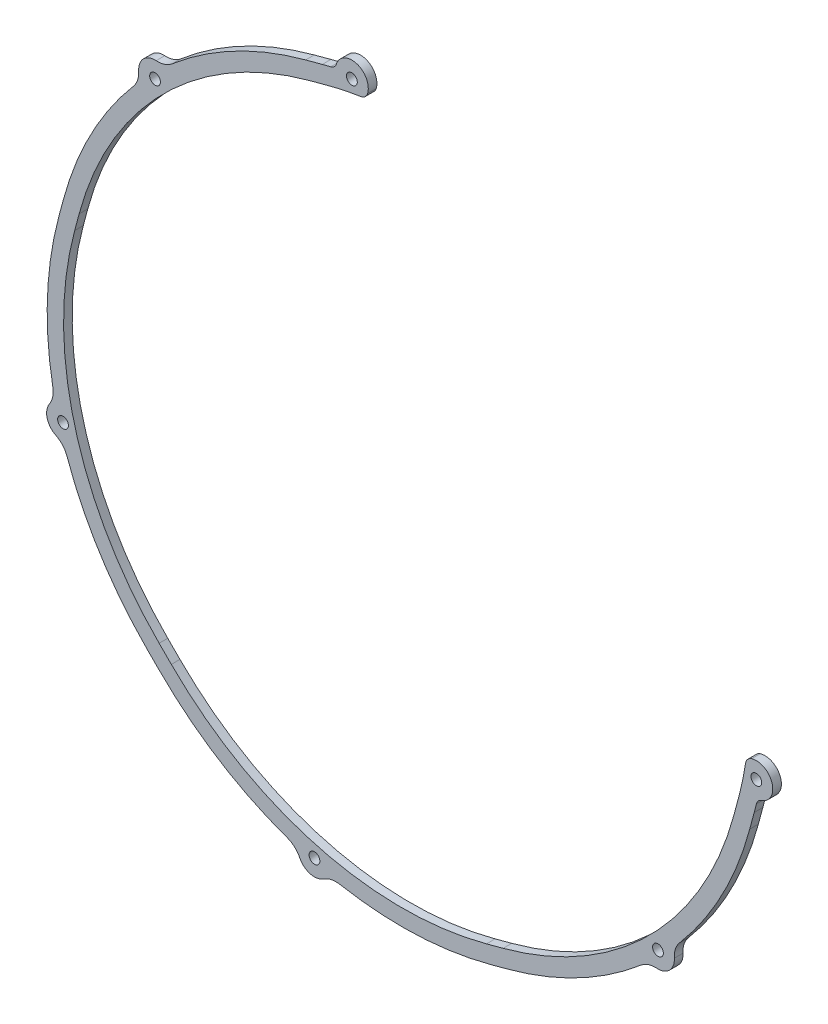
from build123d import *

# Parameters (mm, degrees)
SKETCH_1_R      = 1.249999998
SKETCH_1_R_2    = 1.25
EXTRUDE_1_DEPTH = 2
SKETCH_2_R      = 1.249999998
SKETCH_2_R_2    = 1.25
EXTRUDE_2_DEPTH = 2


with BuildPart() as part:
    # 草图1 → 凸台-拉伸1 (new body)
    with BuildSketch(Plane.XY):
        with BuildLine():
            Line((-6.26112666, -107.981945189), (-5.225850479, -104.118241884))
            ThreePointArc((-5.225850479, -104.118241884), (-4.973189102, -103.150666115), (-4.732884138, -102.17994774))
            ThreePointArc((-4.732884138, -102.17994774), (-4.069242074, -100.937454399), (-2.884606032, -100.175320593))
            ThreePointArc((-2.884606032, -100.175320593), (-1.923934791, -95.399938144), (-6.515491171, -97.026215112))
            ThreePointArc((-6.515491171, -97.026215112), (-7.154297104, -100.225141497), (-7.930442698, -103.393548202))
            Line((-7.930442698, -103.393548202), (-8.965718973, -107.257251863))
            ThreePointArc((-8.965718973, -107.257251863), (-28.541729969, -141.163897516), (-62.448375622, -160.739908512))
            Line((-62.448375622, -160.739908512), (-66.312078927, -161.775184692))
            ThreePointArc((-66.312078927, -161.775184692), (-105.464100918, -161.775184692), (-139.370746572, -142.199173697))
            Line((-139.370746572, -142.199173697), (-142.199173697, -139.370746572))
            ThreePointArc((-142.199173697, -139.370746572), (-161.775184692, -105.464100918), (-161.775184692, -66.312078927))
            Line((-161.775184692, -66.312078927), (-160.739908512, -62.448375622))
            ThreePointArc((-160.739908512, -62.448375622), (-141.163897516, -28.541729969), (-107.257251863, -8.965718973))
            Line((-107.257251863, -8.965718973), (-103.393548557, -7.930442793))
            ThreePointArc((-103.393548557, -7.930442793), (-100.225141676, -7.154297144), (-97.026215112, -6.515491171))
            ThreePointArc((-97.026215112, -6.515491171), (-95.399938144, -1.923934791), (-100.175320593, -2.884606032))
            ThreePointArc((-100.175320593, -2.884606032), (-100.937454399, -4.069242074), (-102.17994774, -4.732884138))
            ThreePointArc((-102.17994774, -4.732884138), (-103.150666115, -4.973189102), (-104.118241884, -5.225850479))
            Line((-104.118241884, -5.225850479), (-107.981945189, -6.26112666))
            ThreePointArc((-107.981945189, -6.26112666), (-124.151656982, -12.583052357), (-138.534502117, -22.307253601))
            ThreePointArc((-138.534502117, -22.307253601), (-140.602334013, -23.470064414), (-142.95588592, -23.768143523))
            ThreePointArc((-142.95588592, -23.768143523), (-145.123695491, -24.581931994), (-145.937483961, -26.749741565))
            ThreePointArc((-145.937483961, -26.749741565), (-146.235563071, -29.103293472), (-147.398373884, -31.171125368))
            ThreePointArc((-147.398373884, -31.171125368), (-157.122575127, -45.553970503), (-163.444500825, -61.723682296))
            Line((-163.444500825, -61.723682296), (-164.479777006, -65.587385601))
            ThreePointArc((-164.479777006, -65.587385601), (-167.089684647, -82.751729635), (-165.859701906, -100.069739522))
            ThreePointArc((-165.859701906, -100.069739522), (-165.88659415, -102.441939881), (-166.805226023, -104.629215177))
            ThreePointArc((-166.805226023, -104.629215177), (-167.184369319, -106.913487571), (-165.713885396, -108.702153845))
            ThreePointArc((-165.713885396, -108.702153845), (-163.824689209, -110.13707388), (-162.615299663, -112.178013531))
            ThreePointArc((-162.615299663, -112.178013531), (-155.02149102, -127.790841407), (-144.179072684, -141.350645559))
            Line((-144.179072684, -141.350645559), (-141.350645559, -144.179072684))
            ThreePointArc((-141.350645559, -144.179072684), (-127.790841407, -155.02149102), (-112.178013531, -162.615299663))
            ThreePointArc((-112.178013531, -162.615299663), (-110.13707388, -163.824689209), (-108.702153845, -165.713885396))
            ThreePointArc((-108.702153845, -165.713885396), (-106.913487571, -167.184369319), (-104.629215177, -166.805226023))
            ThreePointArc((-104.629215177, -166.805226023), (-102.441939881, -165.88659415), (-100.069739522, -165.859701906))
            ThreePointArc((-100.069739522, -165.859701906), (-82.751729635, -167.089684647), (-65.587385601, -164.479777006))
            Line((-65.587385601, -164.479777006), (-61.723682296, -163.444500825))
            ThreePointArc((-61.723682296, -163.444500825), (-45.553970503, -157.122575127), (-31.171125368, -147.398373884))
            ThreePointArc((-31.171125368, -147.398373884), (-29.103293472, -146.235563071), (-26.749741565, -145.937483961))
            ThreePointArc((-26.749741565, -145.937483961), (-24.581931994, -145.123695491), (-23.768143523, -142.95588592))
            ThreePointArc((-23.768143523, -142.95588592), (-23.470064414, -140.602334013), (-22.307253601, -138.534502117))
            ThreePointArc((-22.307253601, -138.534502117), (-12.583052357, -124.151656982), (-6.26112666, -107.981945189))
        make_face()
        with Locations((-97.515193216, -3.758518118)):
            Circle(SKETCH_1_R, mode=Mode.SUBTRACT)
        with Locations((-164.479777006, -106.188794245)):
            Circle(SKETCH_1_R_2, mode=Mode.SUBTRACT)
        with Locations((-106.188794245, -164.479777006)):
            Circle(SKETCH_1_R_2, mode=Mode.SUBTRACT)
        with Locations((-26.561830981, -143.143796504)):
            Circle(SKETCH_1_R_2, mode=Mode.SUBTRACT)
        with Locations((-3.758518118, -97.515193216)):
            Circle(SKETCH_1_R_2, mode=Mode.SUBTRACT)
        with Locations((-143.143796504, -26.561830981)):
            Circle(SKETCH_1_R_2, mode=Mode.SUBTRACT)
    extrude(amount=EXTRUDE_1_DEPTH)

    # 草图2 → 凸台-拉伸2 (add)
    with BuildSketch(Plane(origin=(0, 0, 0), x_dir=(-1, 0, 0), z_dir=(0, 0, -1))):
        with BuildLine():
            Line((4.259924653, -104.377060929), (5.295200833, -108.240764234))
            ThreePointArc((5.295200833, -108.240764234), (11.697726433, -124.616627957), (21.545904088, -139.182843786))
            ThreePointArc((21.545904088, -139.182843786), (22.520552994, -140.916066483), (22.770398003, -142.888774997))
            ThreePointArc((22.770398003, -142.888774997), (23.874825213, -145.830802272), (26.816852488, -146.935229482))
            ThreePointArc((26.816852488, -146.935229482), (28.789561001, -147.185074491), (30.522783699, -148.159723396))
            ThreePointArc((30.522783699, -148.159723396), (45.088999528, -158.007901052), (61.464863251, -164.410426652))
            Line((61.464863251, -164.410426652), (65.328566556, -165.445702832))
            ThreePointArc((65.328566556, -165.445702832), (82.711743348, -168.088884876), (100.250545121, -166.843220759))
            ThreePointArc((100.250545121, -166.843220759), (102.238884461, -166.865761396), (104.072222652, -167.635743529))
            ThreePointArc((104.072222652, -167.635743529), (107.172306616, -168.150295146), (109.599782274, -166.154638392))
            ThreePointArc((109.599782274, -166.154638392), (110.802508655, -164.571145209), (112.513190716, -163.557454775))
            ThreePointArc((112.513190716, -163.557454775), (128.325070661, -155.866830658), (142.05775234, -144.886179465))
            Line((142.05775234, -144.886179465), (144.886179465, -142.05775234))
            ThreePointArc((144.886179465, -142.05775234), (155.866830658, -128.325070661), (163.557454775, -112.513190716))
            ThreePointArc((163.557454775, -112.513190716), (164.571145209, -110.802508655), (166.154638392, -109.599782274))
            ThreePointArc((166.154638392, -109.599782274), (168.150295146, -107.172306616), (167.635743529, -104.072222652))
            ThreePointArc((167.635743529, -104.072222652), (166.865761396, -102.238884461), (166.843220759, -100.250545121))
            ThreePointArc((166.843220759, -100.250545121), (168.088884876, -82.711743348), (165.445702832, -65.328566556))
            Line((165.445702832, -65.328566556), (164.410426652, -61.464863251))
            ThreePointArc((164.410426652, -61.464863251), (158.007901052, -45.088999528), (148.159723396, -30.522783699))
            ThreePointArc((148.159723396, -30.522783699), (147.185074491, -28.789561001), (146.935229482, -26.816852488))
            ThreePointArc((146.935229482, -26.816852488), (145.830802272, -23.874825213), (142.888774997, -22.770398003))
            ThreePointArc((142.888774997, -22.770398003), (140.916066483, -22.520552994), (139.182843786, -21.545904088))
            ThreePointArc((139.182843786, -21.545904088), (124.616627957, -11.697726433), (108.240764234, -5.295200833))
            Line((108.240764234, -5.295200833), (104.377060933, -4.259924654))
            ThreePointArc((104.377060933, -4.259924654), (103.397149286, -4.00404203), (102.414054965, -3.760673355))
            ThreePointArc((102.414054965, -3.760673355), (101.615309246, -3.334046314), (101.125366085, -2.572494572))
            ThreePointArc((101.125366085, -2.572494572), (96.369116464, -0.135465803), (93.879703454, -4.864508258))
            ThreePointArc((93.879703454, -4.864508258), (94.48162483, -5.792369354), (95.484612817, -6.258470902))
            ThreePointArc((95.484612817, -6.258470902), (96.256077841, -6.382999122), (97.026215112, -6.515491171))
            ThreePointArc((97.026215112, -6.515491171), (100.225141676, -7.154297144), (103.393548557, -7.930442793))
            Line((103.393548557, -7.930442793), (107.257251863, -8.965718973))
            ThreePointArc((107.257251863, -8.965718973), (141.163897516, -28.541729969), (160.739908512, -62.448375622))
            Line((160.739908512, -62.448375622), (161.775184692, -66.312078927))
            ThreePointArc((161.775184692, -66.312078927), (161.775184692, -105.464100918), (142.199173697, -139.370746572))
            Line((142.199173697, -139.370746572), (139.370746572, -142.199173697))
            ThreePointArc((139.370746572, -142.199173697), (105.464100918, -161.775184692), (66.312078927, -161.775184692))
            Line((66.312078927, -161.775184692), (62.448375622, -160.739908512))
            ThreePointArc((62.448375622, -160.739908512), (28.541729969, -141.163897516), (8.965718973, -107.257251863))
            Line((8.965718973, -107.257251863), (7.930442698, -103.393548202))
            ThreePointArc((7.930442698, -103.393548202), (7.154297104, -100.225141497), (6.515491171, -97.026215112))
            ThreePointArc((6.515491171, -97.026215112), (6.382999122, -96.256077841), (6.258470902, -95.484612817))
            ThreePointArc((6.258470902, -95.484612817), (5.792369354, -94.48162483), (4.864508258, -93.879703454))
            ThreePointArc((4.864508258, -93.879703454), (0.135465803, -96.369116464), (2.572494572, -101.125366085))
            ThreePointArc((2.572494572, -101.125366085), (3.334046314, -101.615309246), (3.760673355, -102.414054965))
            ThreePointArc((3.760673355, -102.414054965), (4.004042029, -103.397149283), (4.259924653, -104.377060929))
        make_face()
        with Locations(Location((97.515193216, -3.758518118, 0), (0, 0, 180))):
            Circle(SKETCH_2_R, mode=Mode.SUBTRACT)
        with Locations(Location((164.479777006, -106.188794245, 0), (0, 0, 180))):
            Circle(SKETCH_2_R_2, mode=Mode.SUBTRACT)
        with Locations(Location((106.188794245, -164.479777006, 0), (0, 0, 180))):
            Circle(SKETCH_2_R_2, mode=Mode.SUBTRACT)
        with Locations(Location((26.561830981, -143.143796504, 0), (0, 0, 180))):
            Circle(SKETCH_2_R_2, mode=Mode.SUBTRACT)
        with Locations(Location((3.758518118, -97.515193216, 0), (0, 0, 180))):
            Circle(SKETCH_2_R_2, mode=Mode.SUBTRACT)
        with Locations(Location((143.143796504, -26.561830981, 0), (0, 0, 180))):
            Circle(SKETCH_2_R_2, mode=Mode.SUBTRACT)
    extrude(amount=-EXTRUDE_2_DEPTH)


solid = part.part
